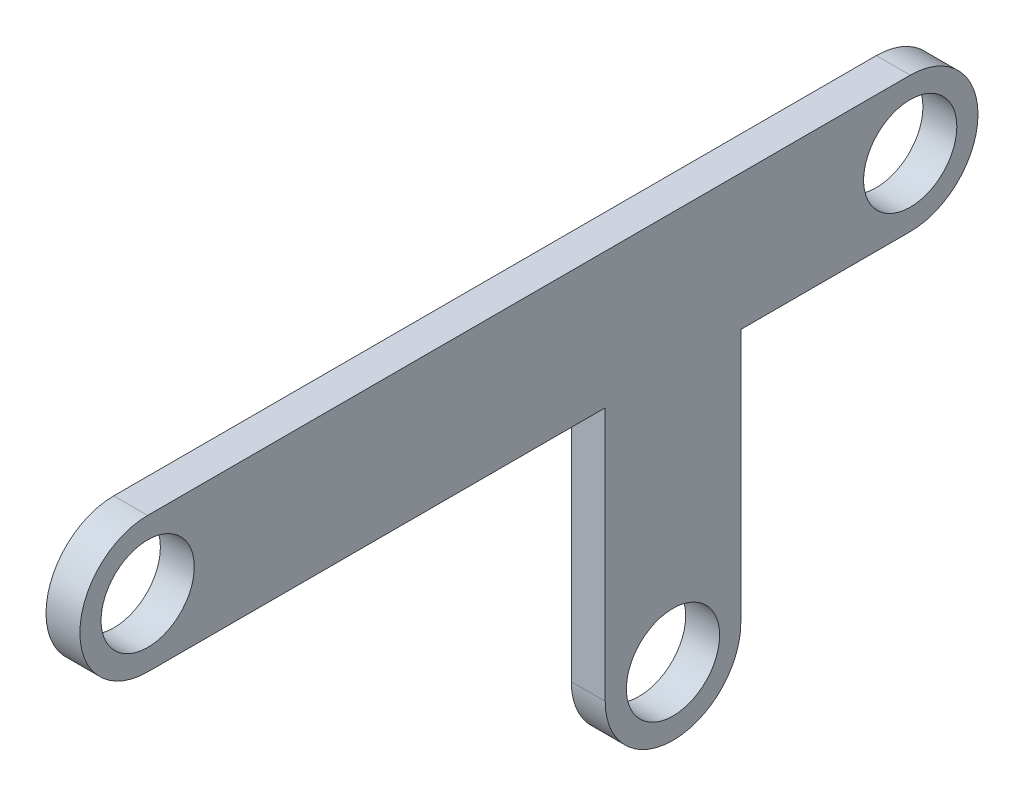
from build123d import *

# Parameters (mm, degrees)
SKETCH1_R           = 2.75
BOSS_EXTRUDE1_DEPTH = 2


with BuildPart() as part:
    # Sketch1 → Boss-Extrude1 (new body)
    with BuildSketch(Plane(origin=(0, 0, 0), x_dir=(0, 0, -1), z_dir=(1, 0, 0))):
        with BuildLine():
            Line((4, 0), (31, 0))
            Line((31, 0), (31, -15))
            ThreePointArc((31, -15), (35, -19), (39, -15))
            Line((39, -15), (39, 0))
            Line((39, 0), (49, 0))
            ThreePointArc((49, 0), (53, 4), (49, 8))
            Line((49, 8), (4, 8))
            ThreePointArc((4, 8), (0, 4), (4, 0))
        make_face()
        with Locations((4, 4)):
            Circle(SKETCH1_R, mode=Mode.SUBTRACT)
        with Locations((35, -15)):
            Circle(SKETCH1_R, mode=Mode.SUBTRACT)
        with Locations((49, 4)):
            Circle(SKETCH1_R, mode=Mode.SUBTRACT)
    extrude(amount=BOSS_EXTRUDE1_DEPTH)


solid = part.part
